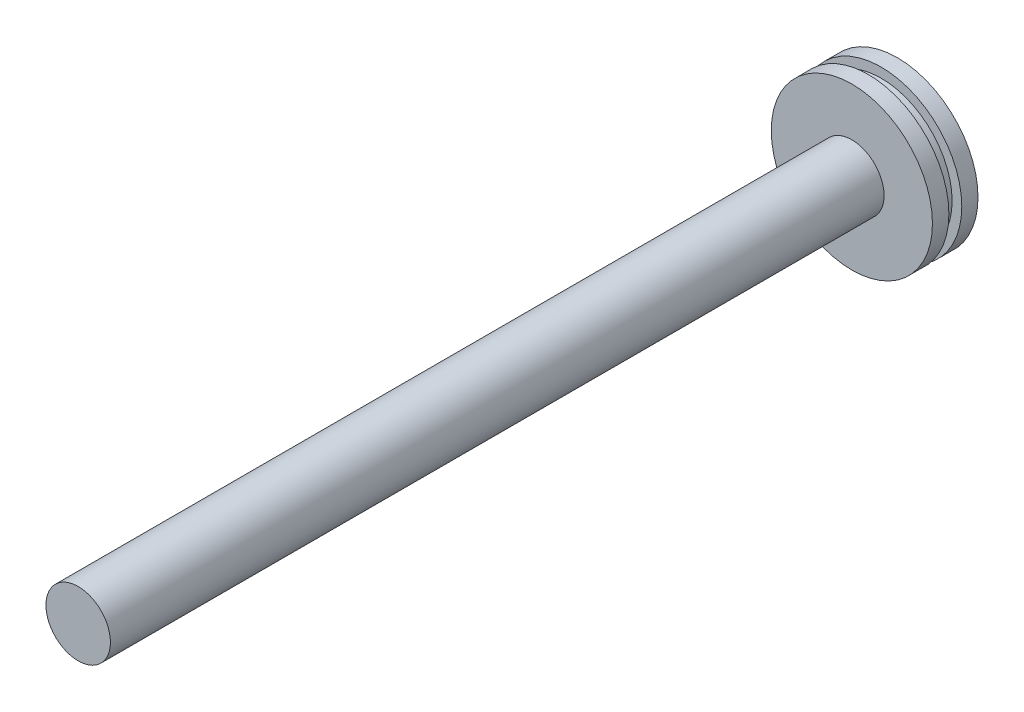
from build123d import *

# Parameters (mm, degrees)
SKETCH1_R           = 50
BOSS_EXTRUDE1_DEPTH = 1200
SKETCH2_R           = 125
BOSS_EXTRUDE2_DEPTH = 70.65
SKETCH5_W           = 15
SKETCH5_H           = 20


with BuildPart() as part:
    # Sketch1 → Boss-Extrude1 (new body)
    with BuildSketch(Plane.XY):
        Circle(SKETCH1_R)
    extrude(amount=BOSS_EXTRUDE1_DEPTH)

    # Sketch2 → Boss-Extrude2 (add)
    with BuildSketch(Plane(origin=(0, 0, 0), x_dir=(-1, 0, 0), z_dir=(0, 0, -1))):
        Circle(SKETCH2_R)
    extrude(amount=BOSS_EXTRUDE2_DEPTH)

    # Sketch5 → Cut-Revolve1 (revolve, cut)
    with BuildSketch(Plane(origin=(0, 0, 0), x_dir=(1, 0, 0), z_dir=(0, 1, 0)), mode=Mode.PRIVATE) as cut_revolve1_sk:
        with Locations((-117.5, 35.486594565)):
            Rectangle(SKETCH5_W, SKETCH5_H)
    revolve(cut_revolve1_sk.sketch.rotate(Axis((0, 0, 1200), (0, 0, -1)), 180), axis=Axis((0, 0, 1200), (0, 0, -1)), mode=Mode.SUBTRACT)


solid = part.part
